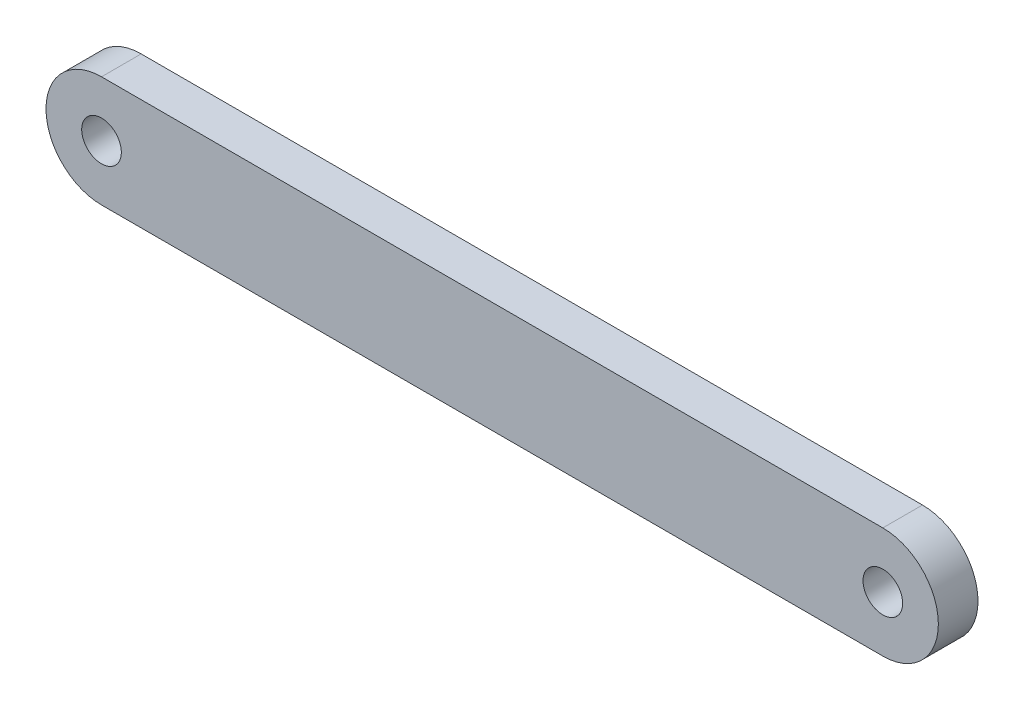
from build123d import *

# Parameters (mm, degrees)
SKETCH1_R           = 3.175
BOSS_EXTRUDE1_DEPTH = 6.35


with BuildPart() as part:
    # Sketch1 → Boss-Extrude1 (new body)
    with BuildSketch(Plane.XY):
        with BuildLine():
            Line((-49.911, -8.773302225), (75.2094, -8.773302225))
            ThreePointArc((75.2094, -8.773302225), (84.0994, 0.116697775), (75.2094, 9.006697775))
            Line((75.2094, 9.006697775), (-49.911, 9.006697775))
            ThreePointArc((-49.911, 9.006697775), (-58.801, 0.116697775), (-49.911, -8.773302225))
        make_face()
        with Locations((-49.911, 0.116697775)):
            Circle(SKETCH1_R, mode=Mode.SUBTRACT)
        with Locations((75.2094, 0.116697775)):
            Circle(SKETCH1_R, mode=Mode.SUBTRACT)
    extrude(amount=BOSS_EXTRUDE1_DEPTH)


solid = part.part
